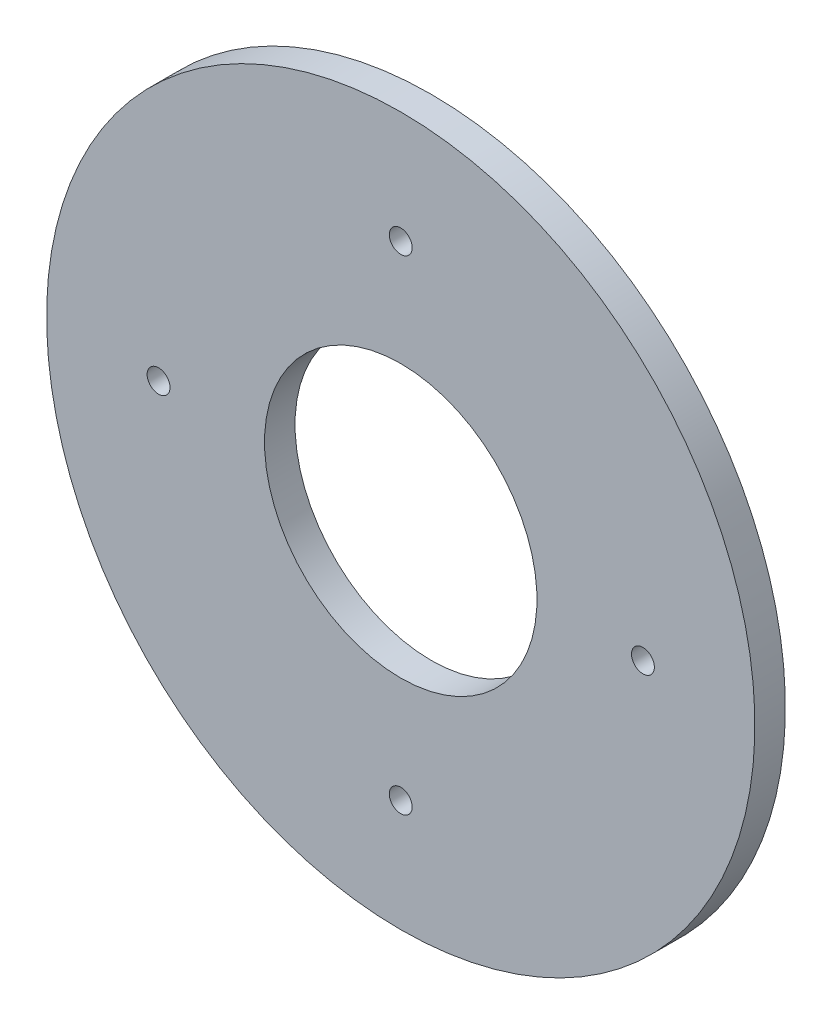
from build123d import *

# Parameters (mm, degrees)
SKETCH_1_W          = 5.6
SKETCH_1_H          = 65
SKETCH_2_R          = 25
CUT_EXTRUDE_1_DEPTH = 93.094299498
SKETCH_3_R          = 2.1
CUT_EXTRUDE_2_DEPTH = 93.094299498


with BuildPart() as part:
    # ｽｹｯﾁ1 → 回転1 (revolve)
    with BuildSketch(Plane(origin=(0, 0, 0), x_dir=(0, 0, -1), z_dir=(1, 0, 0))):
        with Locations((-2.8, 32.5)):
            Rectangle(SKETCH_1_W, SKETCH_1_H)
    revolve(axis=Axis((0, 0, 0), (0, 0, 1)))

    # ｽｹｯﾁ2 → ｶｯﾄ - 押し出し1 (cut, through all)
    with BuildSketch(Plane(origin=(0, 0, 0), x_dir=(-1, 0, 0), z_dir=(0, 0, -1))):
        with Locations(Location((0, 0, 0), (0, 0, 90))):
            Circle(SKETCH_2_R)
    extrude(amount=-CUT_EXTRUDE_1_DEPTH, mode=Mode.SUBTRACT)

    # ｽｹｯﾁ3 → ｶｯﾄ - 押し出し2 (cut, through all)
    with BuildSketch(Plane(origin=(0, 0, 0), x_dir=(-1, 0, 0), z_dir=(0, 0, -1))):
        with Locations(Location((0, 44.45, 0), (0, 0, 90))):
            Circle(SKETCH_3_R)
        with Locations(Location((44.45, 0, 0), (0, 0, 90))):
            Circle(SKETCH_3_R)
        with Locations(Location((0, -44.45, 0), (0, 0, 90))):
            Circle(SKETCH_3_R)
        with Locations(Location((-44.45, 0, 0), (0, 0, 90))):
            Circle(SKETCH_3_R)
    extrude(amount=-CUT_EXTRUDE_2_DEPTH, mode=Mode.SUBTRACT)


solid = part.part
